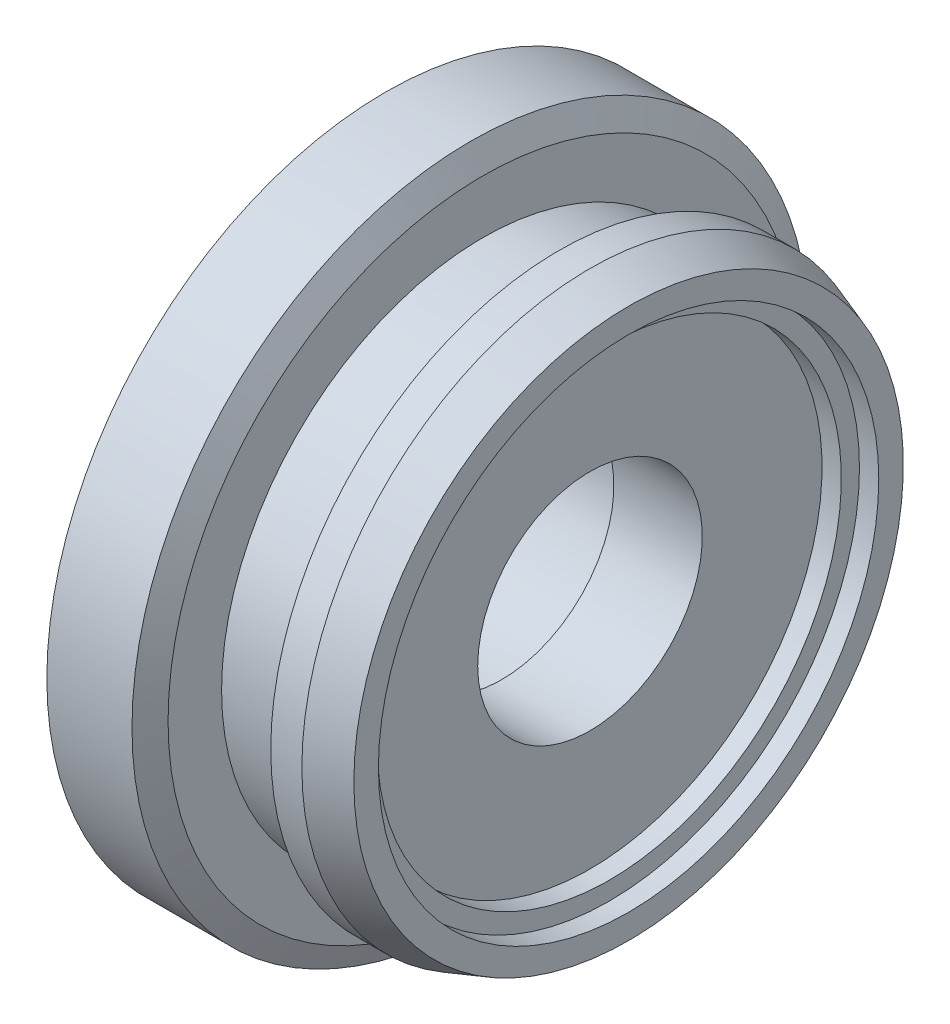
from build123d import *


with BuildPart() as part:
    # Sketch1 → Revolve1 (revolve)
    with BuildSketch(Plane.XY, mode=Mode.PRIVATE) as revolve1_sk:
        Polygon((-3.518513865, 27.976942119), (-3.518513865, 72.321182266), (14.663800852, 72.321182266), (17.322667847, 67.269334975), (17.322667847, 55.836206897), (33.541756517, 55.836206897), (33.541756517, 61.552770936), (40.188924005, 61.552770936), (48.43141169, 58.694488916), (48.43141169, 53.443226601), (44.310167847, 53.443226601), (44.310167847, 49.568339395), (40.188924005, 49.568339395), (40.188924005, 23.990036189), (21.303737569, 23.990036189), (19.205366026, 27.976942119), align=None)
    revolve(revolve1_sk.sketch.rotate(Axis((0, 0, 0), (1, 0, 0)), 90), axis=Axis((0, 0, 0), (1, 0, 0)))


solid = part.part
